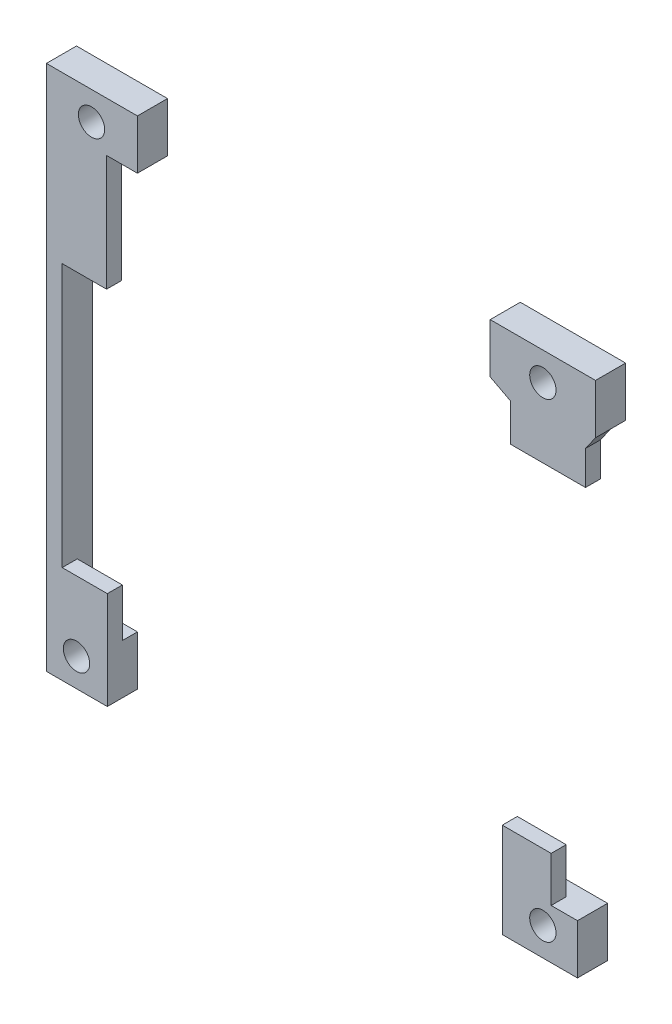
from build123d import *

# Parameters (mm, degrees)
SKETCH1_R             = 1.75
BOSS_EXTRUDE1_DEPTH   = 2
SKETCH2_R             = 1.75
BOSS_EXTRUDE2_DEPTH   = 2
SKETCH3_W             = 14
SKETCH3_H             = 6.6
SKETCH3_R             = 1.75
BOSS_EXTRUDE3_DEPTH   = 2
SKETCH3_W_2           = 10
BOSS_EXTRUDE3_2_DEPTH = 2
SKETCH4_R             = 1.75
BOSS_EXTRUDE4_DEPTH   = 2


with BuildPart() as part:
    # Sketch1 → Boss-Extrude1 (new body)
    with BuildSketch(Plane.XY):
        with BuildLine():
            Line((-45, 35), (-42.9, 35))
            Line((-42.9, 35), (-32.9, 35))
            Line((-32.9, 35), (-32.9, 28.4))
            Line((-32.9, 28.4), (-39.9, 28.4))
            ThreePointArc((-39.9, 28.4), (-42.021320344, 27.521320344), (-42.9, 25.4))
            Line((-42.9, 25.4), (-42.9, -25.4))
            ThreePointArc((-42.9, -25.4), (-42.021320344, -27.521320344), (-39.9, -28.4))
            Line((-39.9, -28.4), (-36.9, -28.4))
            Line((-36.9, -28.4), (-36.9, -35))
            Line((-36.9, -35), (-42.9, -35))
            Line((-42.9, -35), (-45, -35))
            Line((-45, -35), (-45, 35))
        make_face()
        with Locations((-39, 31.25)):
            Circle(SKETCH1_R, mode=Mode.SUBTRACT)
        with Locations((-41, -31.25)):
            Circle(SKETCH1_R, mode=Mode.SUBTRACT)
    extrude(amount=BOSS_EXTRUDE1_DEPTH)

    # Sketch2 → Boss-Extrude2 (add)
    with BuildSketch(Plane.XY.offset(2)):
        Polygon((-45, 35), (-37, 35), (-32.9, 35), (-32.9, 28.4), (-37, 28.4), (-37, 13), (-42.9, 13), (-42.9, -22), (-36.9, -22), (-36.9, -35), (-45, -35), (-45, -22), (-45, 13), align=None)
        with Locations((-41, -31.25)):
            Circle(SKETCH2_R, mode=Mode.SUBTRACT)
        with Locations((-39, 31.25)):
            Circle(SKETCH2_R, mode=Mode.SUBTRACT)
    extrude(amount=BOSS_EXTRUDE2_DEPTH)


with BuildPart() as body_2:
    # Sketch3 → Boss-Extrude3 (new body)
    with BuildSketch(Plane.XY):
        with Locations((21, 31.7)):
            Rectangle(SKETCH3_W, SKETCH3_H)
        with Locations((21, 31.25)):
            Circle(SKETCH3_R, mode=Mode.SUBTRACT)
    extrude(amount=BOSS_EXTRUDE3_DEPTH)



with BuildPart() as body_3:
    # Sketch3 → Boss-Extrude3 2 (new body)
    with BuildSketch(Plane.XY):
        with Locations((20.603475334, -31.7)):
            Rectangle(SKETCH3_W_2, SKETCH3_H)
        with Locations((21, -31.25)):
            Circle(SKETCH3_R, mode=Mode.SUBTRACT)
    extrude(amount=BOSS_EXTRUDE3_2_DEPTH)


with BuildPart() as body_2_1:
    add(body_2.part)

    add(body_3.part)  # Boss-Extrude4 merges body 3
    # Sketch4 → Boss-Extrude4 (add)
    # profile 1 of 2: a face of its own
    with BuildSketch(Plane.XY.offset(2)):
        Polygon((28, 35), (28, 28.4), (26.669605677, 26.5), (26.669605677, 22), (16.669605677, 22), (16.669605677, 27), (14, 28.4), (14, 35), align=None)
        with Locations((21, 31.25)):
            Circle(SKETCH4_R, mode=Mode.SUBTRACT)
    # profile 2 of 2: a face of its own
    with BuildSketch(Plane.XY.offset(2)):
        Polygon((15.603475334, -35), (15.603475334, -28.4), (15.603475334, -22.4), (22.103475334, -22.4), (22.103475334, -28.4), (25.603475334, -28.4), (25.603475334, -35), align=None)
        with Locations((21, -31.25)):
            Circle(SKETCH4_R, mode=Mode.SUBTRACT)
    extrude(amount=BOSS_EXTRUDE4_DEPTH)


solid = Compound([part.part, body_2_1.part])
